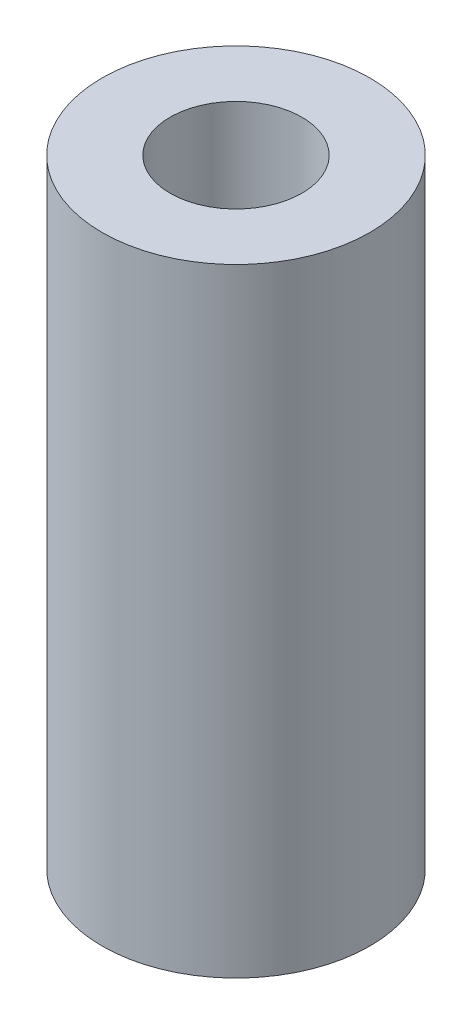
from build123d import *

# Parameters (mm, degrees)
SKETCH1_R           = 3.25
SKETCH1_R_2         = 1.6
BOSS_EXTRUDE1_DEPTH = 15


with BuildPart() as part:
    # Sketch1 → Boss-Extrude1 (new body)
    with BuildSketch(Plane(origin=(0, 0, 0), x_dir=(1, 0, 0), z_dir=(0, 1, 0))):
        with Locations(Location((0, 0, 0), (0, 0, 270))):
            Circle(SKETCH1_R)
        with Locations(Location((0, 0, 0), (0, 0, 270))):
            Circle(SKETCH1_R_2, mode=Mode.SUBTRACT)
    extrude(amount=BOSS_EXTRUDE1_DEPTH)


solid = part.part
